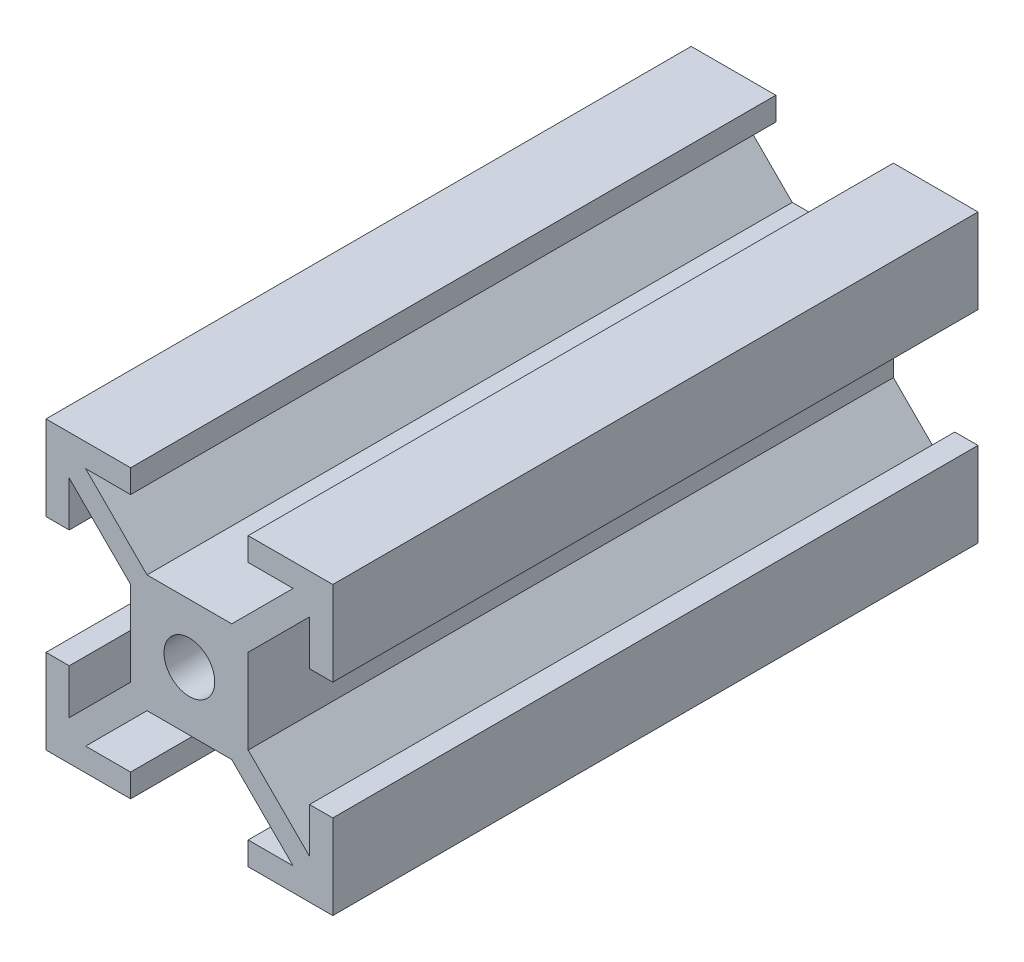
from build123d import *

# Parameters (mm, degrees)
SKETCH1_R           = 1.77
BOSS_EXTRUDE1_DEPTH = 45


with BuildPart() as part:
    # Sketch1 → Boss-Extrude1 (new body)
    with BuildSketch(Plane.XY):
        Polygon((-8.38, 4.1), (-10, 4.1), (-10, 10), (-4.1, 10), (-4.1, 8.38), (-7.234487014, 8.38), (-2.954487014, 4.1), (2.954487014, 4.1), (7.234487014, 8.38), (4.1, 8.38), (4.1, 10), (10, 10), (10, 4.1), (8.38, 4.1), (8.38, 7.234487014), (4.1, 2.954487014), (4.1, -2.954487014), (8.38, -7.234487014), (8.38, -4.1), (10, -4.1), (10, -10), (4.1, -10), (4.1, -8.38), (7.234487014, -8.38), (2.954487014, -4.1), (-2.954487014, -4.1), (-7.234487014, -8.38), (-4.1, -8.38), (-4.1, -10), (-10, -10), (-10, -4.1), (-8.38, -4.1), (-8.38, -7.234487014), (-4.1, -2.954487014), (-4.1, 2.954487014), (-8.38, 7.234487014), align=None)
        with Locations(Location((0, 0, 0), (0, 0, 180))):
            Circle(SKETCH1_R, mode=Mode.SUBTRACT)
    extrude(amount=BOSS_EXTRUDE1_DEPTH)


solid = part.part
